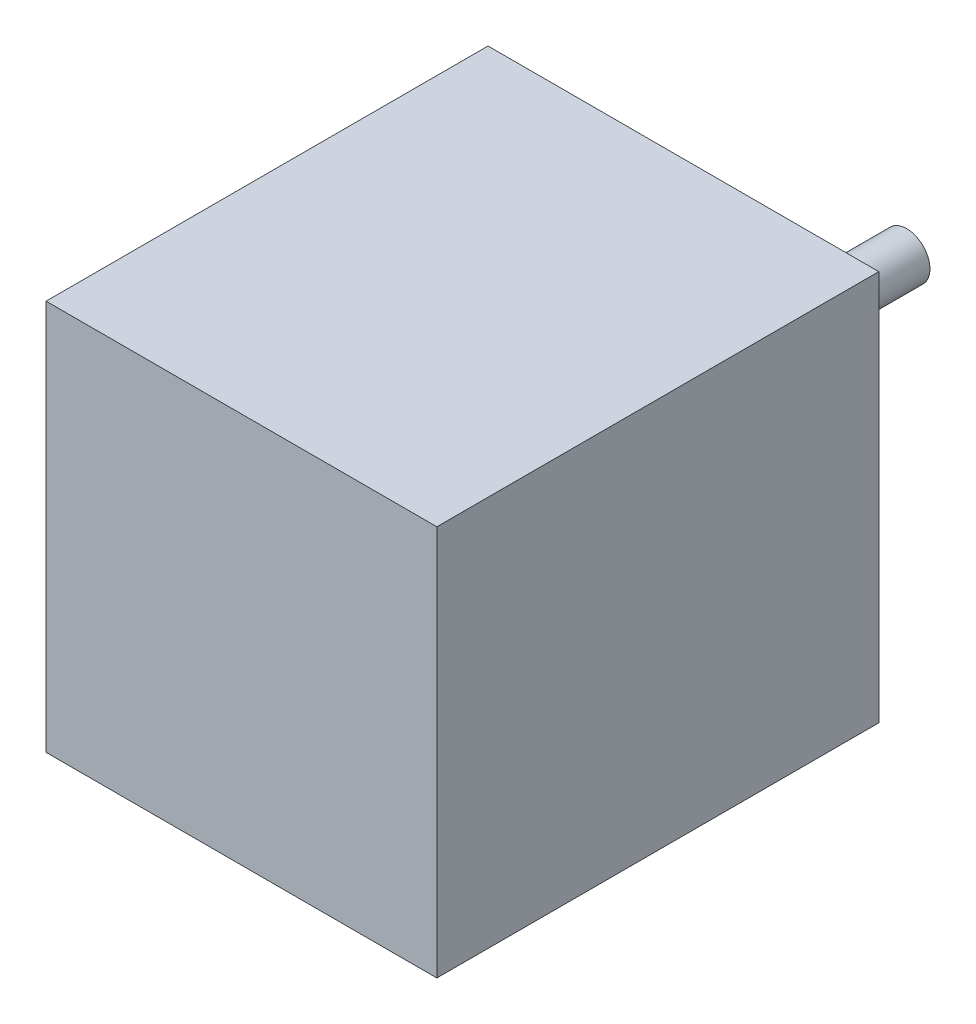
from build123d import *

# Parameters (mm, degrees)
SKETCH_1_W          = 42
SKETCH_1_H          = 42
EXTRUDE_1_DEPTH     = 47.5
SKETCH_3_R          = 11
EXTRUDE_2_DEPTH     = 2
SKETCH_4_R          = 2.5
EXTRUDE_3_DEPTH     = 22
SKETCH_5_R          = 1.5
CUT_EXTRUDE_1_DEPTH = 8


with BuildPart() as part:
    # 草图1 → 凸台-拉伸1 (new body)
    with BuildSketch(Plane.XY):
        with Locations((-21, 21)):
            Rectangle(SKETCH_1_W, SKETCH_1_H)
    extrude(amount=EXTRUDE_1_DEPTH)

    # 草图3 → 凸台-拉伸2 (add)
    with BuildSketch(Plane(origin=(0, 0, 0), x_dir=(-1, 0, 0), z_dir=(0, 0, -1))):
        with Locations((21, 21)):
            Circle(SKETCH_3_R)
    extrude(amount=EXTRUDE_2_DEPTH)

    # 草图4 → 凸台-拉伸3 (add)
    with BuildSketch(Plane(origin=(0, 0, -2), x_dir=(-1, 0, 0), z_dir=(0, 0, -1))):
        with Locations((21, 21)):
            Circle(SKETCH_4_R)
    extrude(amount=EXTRUDE_3_DEPTH)

    # 草图5 → 切除-拉伸1 (cut)
    with BuildSketch(Plane(origin=(0, 0, 0), x_dir=(-1, 0, 0), z_dir=(0, 0, -1))):
        with Locations((5.5, 5.5)):
            Circle(SKETCH_5_R)
        with Locations((36.5, 5.5)):
            Circle(SKETCH_5_R)
        with Locations((36.5, 36.5)):
            Circle(SKETCH_5_R)
        with Locations((5.5, 36.5)):
            Circle(SKETCH_5_R)
    extrude(amount=-CUT_EXTRUDE_1_DEPTH, mode=Mode.SUBTRACT)


solid = part.part
